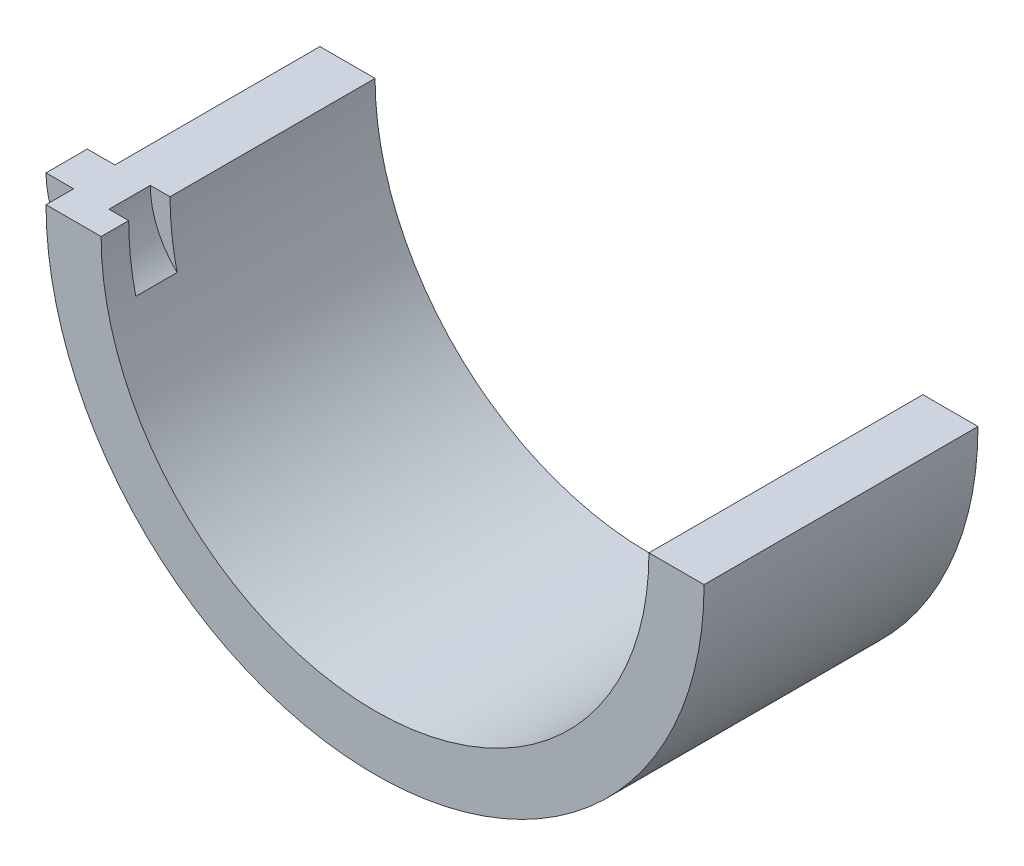
from build123d import *

# Parameters (mm, degrees)
BOSS_EXTRUDE1_DEPTH = 12.6238
BOSS_EXTRUDE2_DEPTH = 1.905
CUT_EXTRUDE2_DEPTH  = 1.905


with BuildPart() as part:
    # Sketch1 → Boss-Extrude1 (new body)
    with BuildSketch(Plane.XY):
        with BuildLine():
            Line((-12.6238, 15.1638), (-15.1638, 15.1638))
            ThreePointArc((-15.1638, 15.1638), (0, 0), (15.1638, 15.1638))
            Line((15.1638, 15.1638), (12.6238, 15.1638))
            ThreePointArc((12.6238, 15.1638), (0, 2.54), (-12.6238, 15.1638))
        make_face()
    extrude(amount=-BOSS_EXTRUDE1_DEPTH)

    # Sketch5 → Boss-Extrude2 (add)
    with BuildSketch(Plane.XY.offset(-1.27)):
        with BuildLine():
            Line((-15.1638, 15.1638), (-16.4338, 15.1638))
            ThreePointArc((-16.4338, 15.1638), (-16.013233813, 13.423731487), (-14.844383501, 12.067817294))
            ThreePointArc((-14.844383501, 12.067817294), (-15.083734501, 13.607591803), (-15.1638, 15.1638))
        make_face()
    extrude(amount=-BOSS_EXTRUDE2_DEPTH)

    # Sketch6 → Cut-Extrude2 (cut)
    with BuildSketch(Plane.XY.offset(-1.27)):
        with BuildLine():
            Line((-12.6238, 15.1638), (-13.53163737, 15.1638))
            ThreePointArc((-13.53163737, 15.1638), (-13.209395554, 13.605961457), (-12.29555905, 12.303808027))
            ThreePointArc((-12.29555905, 12.303808027), (-12.541471301, 13.724416781), (-12.6238, 15.1638))
        make_face()
    extrude(amount=-CUT_EXTRUDE2_DEPTH, mode=Mode.SUBTRACT)


solid = part.part
